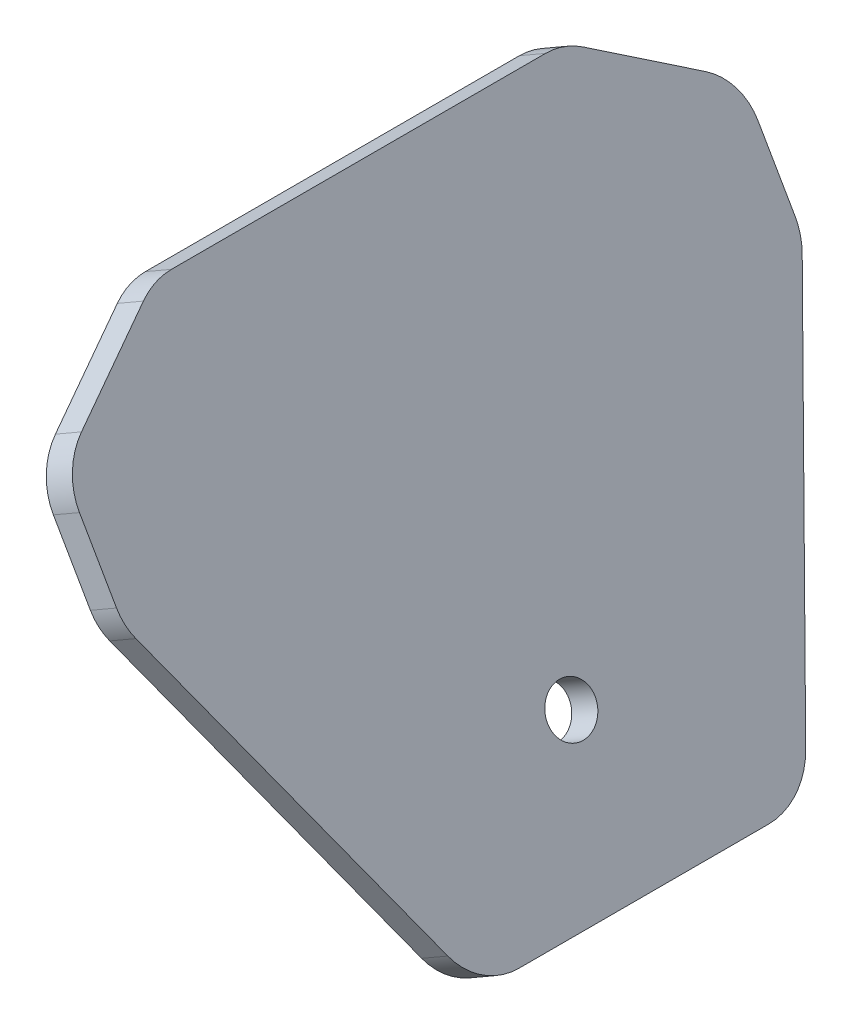
from build123d import *

# Parameters (mm, degrees)
BOSS_EXTRUDE1_DEPTH = 3.175
FILLET1_R           = 6.35
SKETCH2_R           = 2.5
CUT_EXTRUDE1_DEPTH  = 12.192


with BuildPart() as part:
    # Sketch1 → Boss-Extrude1 (new body)
    with BuildSketch(Plane(origin=(460.696994896, 265.983534018, 0), x_dir=(0, 0, -1), z_dir=(0.8660254037844387, 0.49999999999999983, 1.3508489681243032e-15))):
        Polygon((-748.209864924, 226.045570747), (-705.029864924, 226.045570747), (-690.886483256, 216.780668208), (-690.886483256, 204.080668208), (-709.514191369, 165.980668208), (-743.725538479, 165.980668208), (-762.353246592, 204.080668208), (-762.353246592, 216.780668208), align=None)
    extrude(amount=BOSS_EXTRUDE1_DEPTH)

    # Fillet1
    fillet1_edges = [part.edges().sort_by_distance(p)[0] for p in [
        (349.04902485, 462.538490698, 748.209864924),
        (349.04902485, 462.538490698, 705.029864924),
        (353.68147612, 454.514849736, 690.886483256),
        (360.03147612, 443.516327108, 690.886483256),
        (379.08147612, 410.520759223, 709.514191369),
        (379.08147612, 410.520759223, 743.725538479),
        (360.03147612, 443.516327108, 762.353246592),
        (353.68147612, 454.514849736, 762.353246592),
    ]]
    fillet(fillet1_edges, radius=FILLET1_R)

    # Sketch2 → Cut-Extrude1 (cut)
    with BuildSketch(Plane(origin=(463.446625553, 267.571034018, 0), x_dir=(0, 0, -1), z_dir=(0.8660254037844395, 0.4999999999999987, 3.3569404763321265e-15))):
        with Locations(Location((-726.619864924, 181.220668208, 0), (0, 0, 90))):
            Circle(SKETCH2_R)
    extrude(amount=-CUT_EXTRUDE1_DEPTH, mode=Mode.SUBTRACT)


solid = part.part
